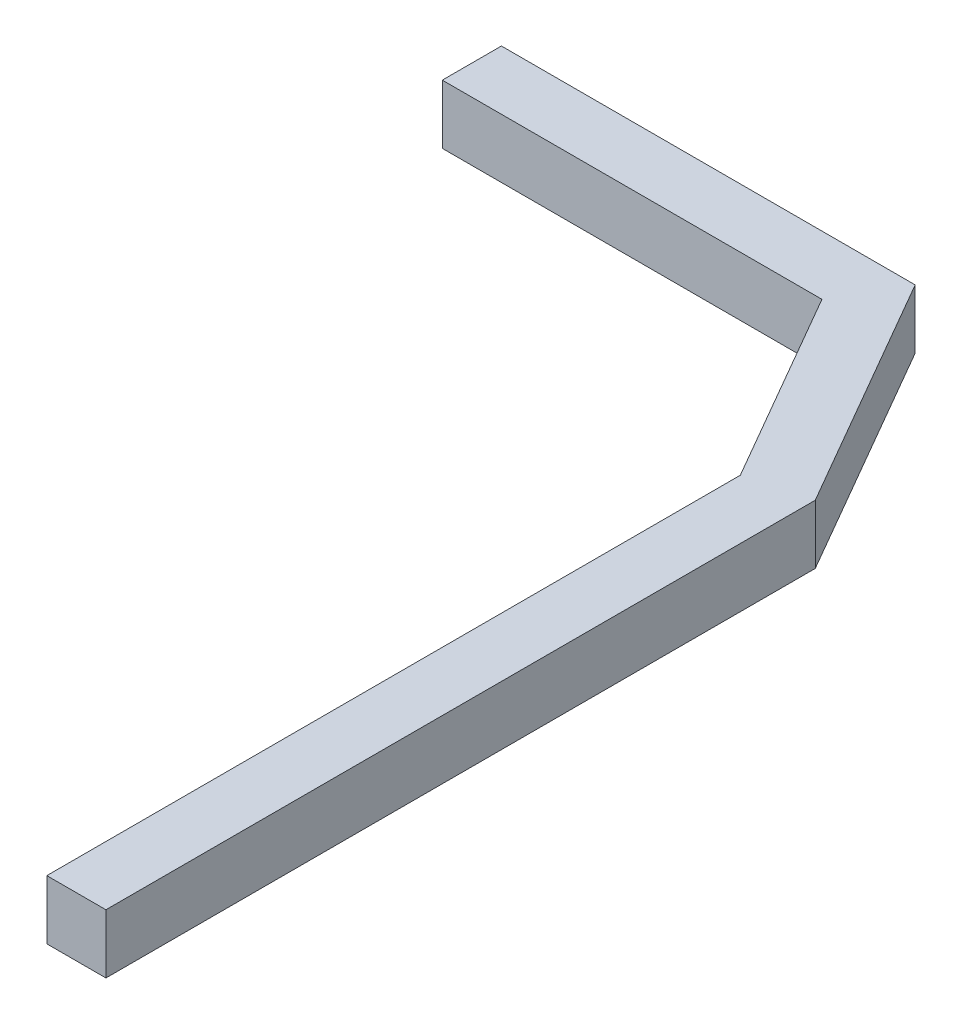
from build123d import *

# Parameters (mm, degrees)
BOSS_EXTRUDE1_DEPTH = 2.5


with BuildPart() as part:
    # Sketch1 → Boss-Extrude1 (new, symmetric)
    with BuildSketch(Plane(origin=(0, 0, 0), x_dir=(1, 0, 0), z_dir=(0, 1, 0))):
        Polygon((-41.547005384, 80), (-41.547005384, 75), (-9.43375673, 75), (0, 58.660254038), (0, 0), (5, 0), (5, 60), (-6.547005384, 80), align=None)
    extrude(amount=BOSS_EXTRUDE1_DEPTH, both=True)


solid = part.part
